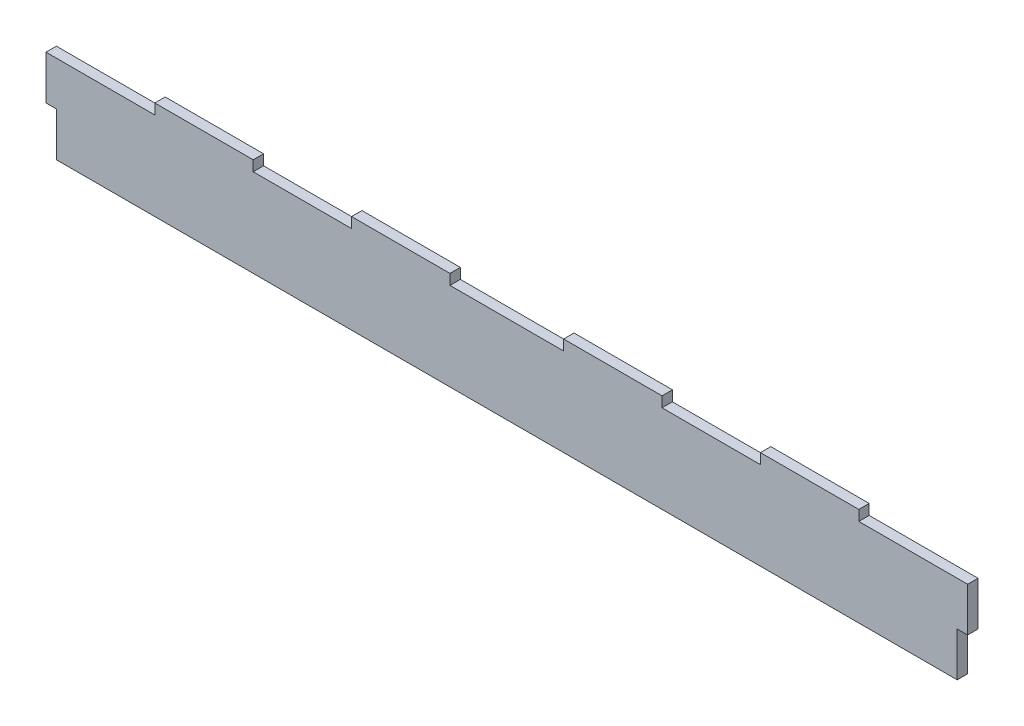
from build123d import *

# Parameters (mm, degrees)
SALIENTE_EXTRUIR1_DEPTH = 3


with BuildPart() as part:
    # Croquis1 → Saliente-Extruir1 (new body)
    with BuildSketch(Plane.XY):
        Polygon((0, 25.4), (0, 12.7), (3, 12.7), (3, 0), (263, 0), (263, 12.7), (266, 12.7), (266, 25.4), (263, 25.4), (234.6, 25.4), (234.6, 28.4), (206.2, 28.4), (206.2, 25.4), (177.8, 25.4), (177.8, 28.4), (149.4, 28.4), (149.4, 25.4), (116.6, 25.4), (116.6, 28.4), (88.2, 28.4), (88.2, 25.4), (59.8, 25.4), (59.8, 28.4), (31.4, 28.4), (31.4, 25.4), (3, 25.4), align=None)
    extrude(amount=SALIENTE_EXTRUIR1_DEPTH)


solid = part.part
